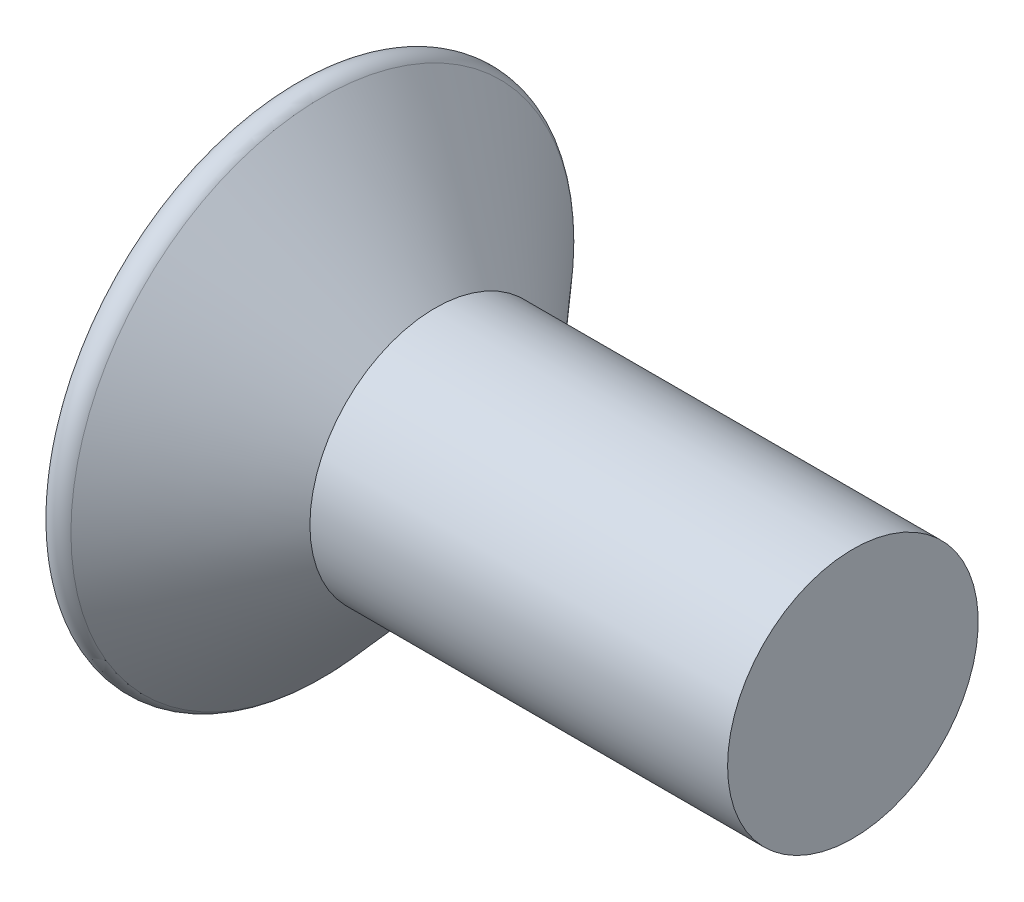
from build123d import *

# Parameters (mm, degrees)
CONG_1_R                = 0.2
ENL_V_MAT_EXTRU_1_DEPTH = 0.2


with BuildPart() as part:
    # Esquisse1 → Révolution1 (revolve)
    with BuildSketch(Plane.XY, mode=Mode.PRIVATE) as r_volution1_sk:
        Polygon((0, 0), (0, 3.4), (1.7, 1.5), (6.7, 1.5), (6.7, 0), align=None)
    revolve(r_volution1_sk.sketch.rotate(Axis((0, 0, 0), (1, 0, 0)), 90), axis=Axis((0, 0, 0), (1, 0, 0)))

    # Congé1
    cong_1_edges = [part.edges().sort_by_distance(p)[0] for p in [
        (0, 0, -3.4),
    ]]
    fillet(cong_1_edges, radius=CONG_1_R)

    # Esquisse2 → Enlèv. mat.-Extru.1 (cut)
    with BuildSketch(Plane.ZY):
        Polygon((0.5, -0.866025404), (1, 0), (0.5, 0.866025404), (-0.5, 0.866025404), (-1, 0), (-0.5, -0.866025404), align=None)
    extrude(amount=-ENL_V_MAT_EXTRU_1_DEPTH, mode=Mode.SUBTRACT)


solid = part.part
